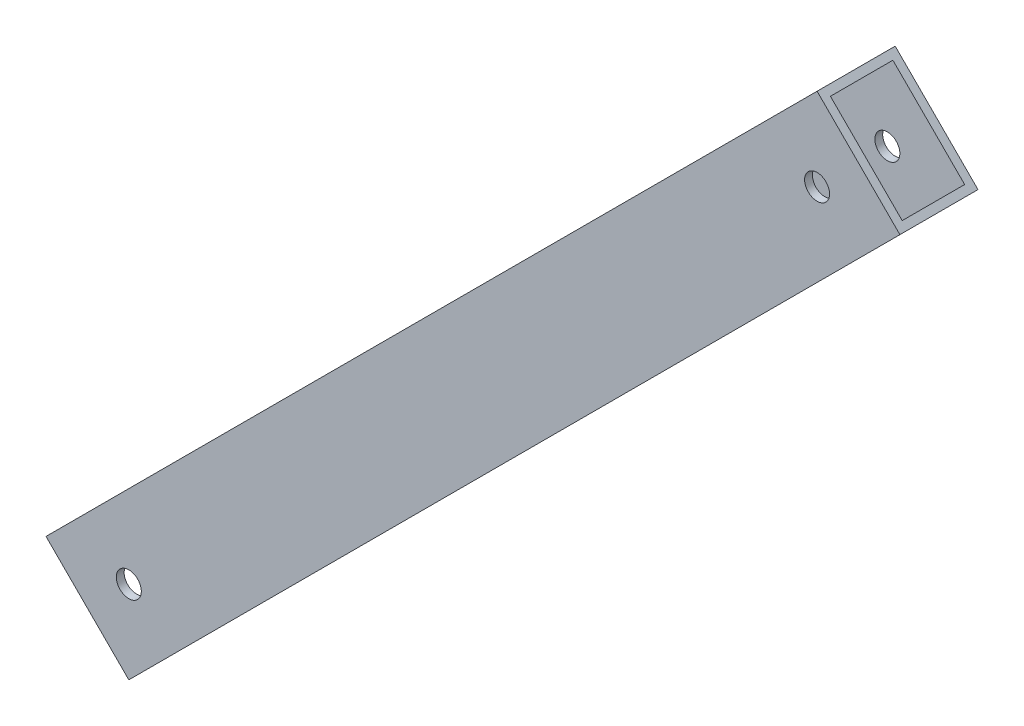
from build123d import *

# Parameters (mm, degrees)
SKETCH_1_R          = 1.6
EXTRUDE_1_DEPTH     = 10
SKETCH_2_R          = 1.6
CUT_EXTRUDE_1_DEPTH = 20
SKETCH_3_W          = 8
SKETCH_3_H          = 13
CUT_EXTRUDE_2_DEPTH = 1000


with BuildPart() as part:
    # ｽｹｯﾁ1 → ﾎﾞｽ - 押し出し1 (new body)
    with BuildSketch(Plane.XY):
        Polygon((177.355249325, -106.251352393), (166.748647607, -95.644750675), (265.5, 3.106601718), (276.106601718, -7.5), align=None)
        with Locations((265.5, -7.5)):
            Circle(SKETCH_1_R, mode=Mode.SUBTRACT)
        with Locations((177.355249325, -95.644750675)):
            Circle(SKETCH_1_R, mode=Mode.SUBTRACT)
    extrude(amount=EXTRUDE_1_DEPTH)

    # ｽｹｯﾁ2 → ｶｯﾄ - 押し出し1 (cut)
    with BuildSketch(Plane(origin=(131.196699141, -131.196699141, 0), x_dir=(0.7071067811865585, 0.7071067811865366, 0), z_dir=(-0.7071067811865366, 0.7071067811865585, 0))):
        with Locations(Location((70.278047689, -5, 0), (0, 0, 180))):
            Circle(SKETCH_2_R)
    extrude(amount=-CUT_EXTRUDE_1_DEPTH, mode=Mode.SUBTRACT)

    # ｽｹｯﾁ3 → ｶｯﾄ - 押し出し2 (cut)
    with BuildSketch(Plane(origin=(35.551948466, 35.551948466, 0), x_dir=(0, 0, 1), z_dir=(-0.7071067811865581, -0.7071067811865369, 0))):
        with Locations((5, -193.040151264)):
            Rectangle(SKETCH_3_W, SKETCH_3_H)
    extrude(amount=-CUT_EXTRUDE_2_DEPTH, mode=Mode.SUBTRACT)


solid = part.part
